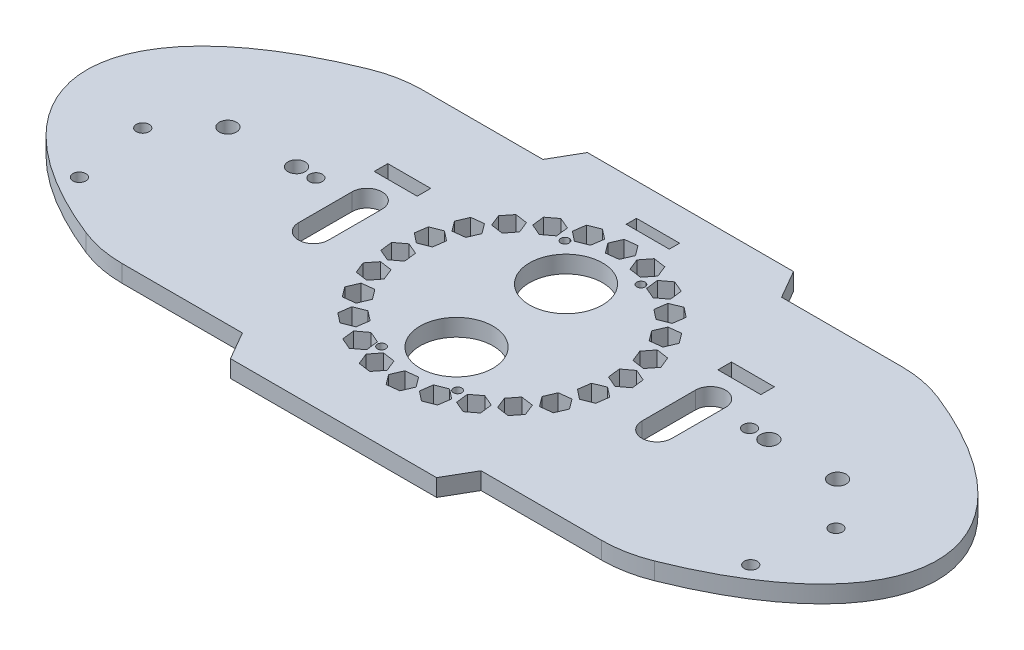
from build123d import *

# Parameters (mm, degrees)
SKETCH2_R           = 1.5
SKETCH2_R_2         = 2
SKETCH2_R_3         = 8.5
SKETCH2_R_4         = 0.975
SKETCH2_W           = 10.004797405
SKETCH2_H           = 3.154186914
SKETCH2_W_2         = 10.04138254
SKETCH2_H_2         = 2.399948426
BOSS_EXTRUDE1_DEPTH = 4


with BuildPart() as part:
    # Sketch2 → Boss-Extrude1 (new body)
    with BuildSketch(Plane(origin=(0, 0, 0), x_dir=(1, 0, 0), z_dir=(0, 1, 0))):
        with BuildLine():
            Line((-27.792740578, -35), (-55.792740578, -35))
            ThreePointArc((-55.792740578, -35), (-61.069714417, -34.498246255), (-66.157563872, -33.01096765))
            add(Edge.make_bspline(
                [(-66.157563872, -33.01096765), (-149, 0), (-66.157563872, 33.01096765)],
                knots=[0, 0, 0, 1, 1, 1], degree=2, weights=[1, 0.656848723, 1]))
            ThreePointArc((-66.157563872, 33.01096765), (-61.069714417, 34.498246255), (-55.792740578, 35))
            Line((-55.792740578, 35), (-27.792740578, 35))
            Line((-27.792740578, 35), (-24, 41.569219382))
            Line((-24, 41.569219382), (24, 41.569219382))
            Line((24, 41.569219382), (27.792740578, 35))
            Line((27.792740578, 35), (55.792740578, 35))
            ThreePointArc((55.792740578, 35), (61.069714417, 34.498246255), (66.157563872, 33.01096765))
            add(Edge.make_bspline(
                [(66.157563872, -33.01096765), (149, 0), (66.157563872, 33.01096765)],
                knots=[0, 0, 0, 1, 1, 1], degree=2, weights=[1, 0.656848723, 1]))
            ThreePointArc((66.157563872, -33.01096765), (61.069714417, -34.498246255), (55.792740578, -35))
            Line((55.792740578, -35), (27.792740578, -35))
            Line((27.792740578, -35), (24, -41.569219382))
            Line((24, -41.569219382), (-24, -41.569219382))
            Line((-24, -41.569219382), (-27.792740578, -35))
        make_face()
        with Locations(Location((-78.186923966, -22.583607212, 0), (0, 0, 270))):
            Circle(SKETCH2_R, mode=Mode.SUBTRACT)
        with Locations(Location((-71, 4.826448313, 0), (0, 0, 270))):
            Circle(SKETCH2_R_2, mode=Mode.SUBTRACT)
        with Locations(Location((-55, 4.826448313, 0), (0, 0, 270))):
            Circle(SKETCH2_R_2, mode=Mode.SUBTRACT)
        with Locations(Location((71, 4.826448313, 0), (0, 0, 90))):
            Circle(SKETCH2_R_2, mode=Mode.SUBTRACT)
        with Locations(Location((55, 4.826448313, 0), (0, 0, 90))):
            Circle(SKETCH2_R_2, mode=Mode.SUBTRACT)
        with Locations(Location((-80.733539652, -5.269891593, 0), (0, 0, 270))):
            Circle(SKETCH2_R, mode=Mode.SUBTRACT)
        with Locations(Location((78.186923966, -22.583607212, 0), (0, 0, 90))):
            Circle(SKETCH2_R, mode=Mode.SUBTRACT)
        with Locations(Location((80.733539652, -5.269891593, 0), (0, 0, 90))):
            Circle(SKETCH2_R, mode=Mode.SUBTRACT)
        with Locations(Location((0.00636129, 12.57554142, 0), (0, 0, 270))):
            Circle(SKETCH2_R_3, mode=Mode.SUBTRACT)
        with Locations(Location((0.00636129, -12.92445858, 0), (0, 0, 270))):
            Circle(SKETCH2_R_3, mode=Mode.SUBTRACT)
        with Locations(Location((-8.84363871, 21.17554142, 0), (0, 0, 270))):
            Circle(SKETCH2_R_4, mode=Mode.SUBTRACT)
        with Locations(Location((8.85636129, 21.17554142, 0), (0, 0, 270))):
            Circle(SKETCH2_R_4, mode=Mode.SUBTRACT)
        with Locations(Location((8.85636129, -21.52445858, 0), (0, 0, 270))):
            Circle(SKETCH2_R_4, mode=Mode.SUBTRACT)
        with Locations(Location((-8.84363871, -21.52445858, 0), (0, 0, 270))):
            Circle(SKETCH2_R_4, mode=Mode.SUBTRACT)
        with Locations(Location((-50.5, 4.826448313, 0), (0, 0, 270))):
            Circle(SKETCH2_R, mode=Mode.SUBTRACT)
        with Locations(Location((50.5, 4.826448313, 0), (0, 0, 270))):
            Circle(SKETCH2_R, mode=Mode.SUBTRACT)
        with Locations((40.023080685, 14.513403304)):
            Rectangle(SKETCH2_W, SKETCH2_H, mode=Mode.SUBTRACT)
        with Locations((-40.023080685, 14.513403304)):
            Rectangle(SKETCH2_W, SKETCH2_H, mode=Mode.SUBTRACT)
        Polygon((-9.477289903, 26.799178082), (-9.886891021, 23.941633637), (-7.616985498, 22.15813644), (-4.937478857, 23.232183689), (-4.527877738, 26.089728134), (-6.797783261, 27.873225331), align=None, mode=Mode.SUBTRACT)
        Polygon((-13.092390726, 19.431695337), (-10.782169943, 21.162652663), (-11.126112569, 24.028841213), (-13.780275978, 25.164072437), (-16.090496761, 23.43311511), (-15.746554135, 20.56692656), align=None, mode=Mode.SUBTRACT)
        Polygon((-2.218221399, 28.338921356), (-3.353452623, 25.684757947), (-1.622495296, 23.374537163), (1.243693254, 23.718479789), (2.378924477, 26.372643199), (0.64796715, 28.682863982), align=None, mode=Mode.SUBTRACT)
        Polygon((5.192015226, 27.947413971), (3.40851803, 25.677508448), (4.482565279, 22.998001807), (7.340109724, 22.588400689), (9.123606921, 24.858306211), (8.049559672, 27.537812853), align=None, mode=Mode.SUBTRACT)
        Polygon((12.248424595, 25.65133651), (9.938203812, 23.920379183), (10.282146438, 21.054190633), (12.936309847, 19.91895941), (15.24653063, 21.649916736), (14.902588004, 24.516105286), align=None, mode=Mode.SUBTRACT)
        Polygon((18.470124069, 21.607162856), (15.790617427, 20.533115607), (15.381016309, 17.675571162), (17.650921832, 15.892073965), (20.330428473, 16.966121214), (20.740029591, 19.823665659), align=None, mode=Mode.SUBTRACT)
        Polygon((23.43311511, 16.090496761), (20.56692656, 15.746554135), (19.431695337, 13.092390726), (21.162652664, 10.782169943), (24.028841213, 11.126112569), (25.164072437, 13.780275978), align=None, mode=Mode.SUBTRACT)
        Polygon((26.799178082, 9.477289903), (23.941633637, 9.886891021), (22.15813644, 7.616985498), (23.232183689, 4.937478857), (26.089728134, 4.527877738), (27.873225331, 6.797783261), align=None, mode=Mode.SUBTRACT)
        Polygon((28.338921356, 2.218221399), (25.684757947, 3.353452623), (23.374537163, 1.622495296), (23.718479789, -1.243693254), (26.372643199, -2.378924477), (28.682863982, -0.64796715), align=None, mode=Mode.SUBTRACT)
        Polygon((27.947413971, -5.192015226), (25.677508448, -3.40851803), (22.998001807, -4.482565279), (22.588400689, -7.340109724), (24.858306211, -9.123606921), (27.537812853, -8.049559672), align=None, mode=Mode.SUBTRACT)
        Polygon((25.65133651, -12.248424595), (23.920379183, -9.938203812), (21.054190633, -10.282146438), (19.91895941, -12.936309847), (21.649916736, -15.24653063), (24.516105286, -14.902588004), align=None, mode=Mode.SUBTRACT)
        Polygon((21.607162856, -18.470124068), (20.533115607, -15.790617427), (17.675571162, -15.381016309), (15.892073965, -17.650921832), (16.966121214, -20.330428473), (19.823665659, -20.740029591), align=None, mode=Mode.SUBTRACT)
        Polygon((16.090496761, -23.43311511), (15.746554135, -20.56692656), (13.092390726, -19.431695337), (10.782169943, -21.162652663), (11.126112569, -24.028841213), (13.780275978, -25.164072437), align=None, mode=Mode.SUBTRACT)
        Polygon((9.477289903, -26.799178082), (9.886891021, -23.941633637), (7.616985498, -22.15813644), (4.937478857, -23.232183689), (4.527877738, -26.089728134), (6.797783261, -27.873225331), align=None, mode=Mode.SUBTRACT)
        Polygon((2.218221399, -28.338921356), (3.353452623, -25.684757947), (1.622495296, -23.374537163), (-1.243693254, -23.718479789), (-2.378924477, -26.372643199), (-0.64796715, -28.682863982), align=None, mode=Mode.SUBTRACT)
        Polygon((-5.192015226, -27.947413971), (-3.40851803, -25.677508448), (-4.482565279, -22.998001807), (-7.340109724, -22.588400689), (-9.123606921, -24.858306211), (-8.049559672, -27.537812853), align=None, mode=Mode.SUBTRACT)
        Polygon((-12.248424595, -25.65133651), (-9.938203812, -23.920379183), (-10.282146438, -21.054190633), (-12.936309847, -19.91895941), (-15.24653063, -21.649916736), (-14.902588004, -24.516105286), align=None, mode=Mode.SUBTRACT)
        Polygon((-18.470124068, -21.607162856), (-15.790617427, -20.533115607), (-15.381016309, -17.675571162), (-17.650921832, -15.892073965), (-20.330428473, -16.966121214), (-20.740029591, -19.823665659), align=None, mode=Mode.SUBTRACT)
        Polygon((-23.43311511, -16.090496761), (-20.56692656, -15.746554135), (-19.431695337, -13.092390726), (-21.162652663, -10.782169943), (-24.028841213, -11.126112569), (-25.164072437, -13.780275978), align=None, mode=Mode.SUBTRACT)
        Polygon((-26.799178082, -9.477289903), (-23.941633637, -9.886891021), (-22.15813644, -7.616985498), (-23.232183689, -4.937478857), (-26.089728134, -4.527877738), (-27.873225331, -6.797783261), align=None, mode=Mode.SUBTRACT)
        Polygon((-28.338921356, -2.218221399), (-25.684757947, -3.353452623), (-23.374537163, -1.622495296), (-23.718479789, 1.243693254), (-26.372643199, 2.378924477), (-28.682863982, 0.64796715), align=None, mode=Mode.SUBTRACT)
        Polygon((-27.947413971, 5.192015226), (-25.677508448, 3.40851803), (-22.998001807, 4.482565279), (-22.588400689, 7.340109724), (-24.858306211, 9.123606921), (-27.537812853, 8.049559672), align=None, mode=Mode.SUBTRACT)
        Polygon((-25.65133651, 12.248424595), (-23.920379183, 9.938203812), (-21.054190633, 10.282146438), (-19.91895941, 12.936309847), (-21.649916736, 15.24653063), (-24.516105286, 14.902588004), align=None, mode=Mode.SUBTRACT)
        Polygon((-21.607162856, 18.470124069), (-20.533115607, 15.790617427), (-17.675571162, 15.381016309), (-15.892073965, 17.650921832), (-16.966121214, 20.330428473), (-19.823665659, 20.740029591), align=None, mode=Mode.SUBTRACT)
        with BuildLine():
            Line((-36.49363871, -6.232557622), (-36.49363871, 6.232557622))
            ThreePointArc((-36.49363871, 6.232557622), (-39.99363871, 9.732557622), (-43.49363871, 6.232557622))
            Line((-43.49363871, 6.232557622), (-43.49363871, -6.232557622))
            ThreePointArc((-43.49363871, -6.232557622), (-39.99363871, -9.732557622), (-36.49363871, -6.232557622))
        make_face(mode=Mode.SUBTRACT)
        with BuildLine():
            Line((36.49363871, -6.232557622), (36.49363871, 6.232557622))
            ThreePointArc((36.49363871, 6.232557622), (39.99363871, 9.732557622), (43.49363871, 6.232557622))
            Line((43.49363871, 6.232557622), (43.49363871, -6.232557622))
            ThreePointArc((43.49363871, -6.232557622), (39.99363871, -9.732557622), (36.49363871, -6.232557622))
        make_face(mode=Mode.SUBTRACT)
        with Locations((0, 32.817327087)):
            Rectangle(SKETCH2_W_2, SKETCH2_H_2, mode=Mode.SUBTRACT)
    extrude(amount=BOSS_EXTRUDE1_DEPTH)


solid = part.part
